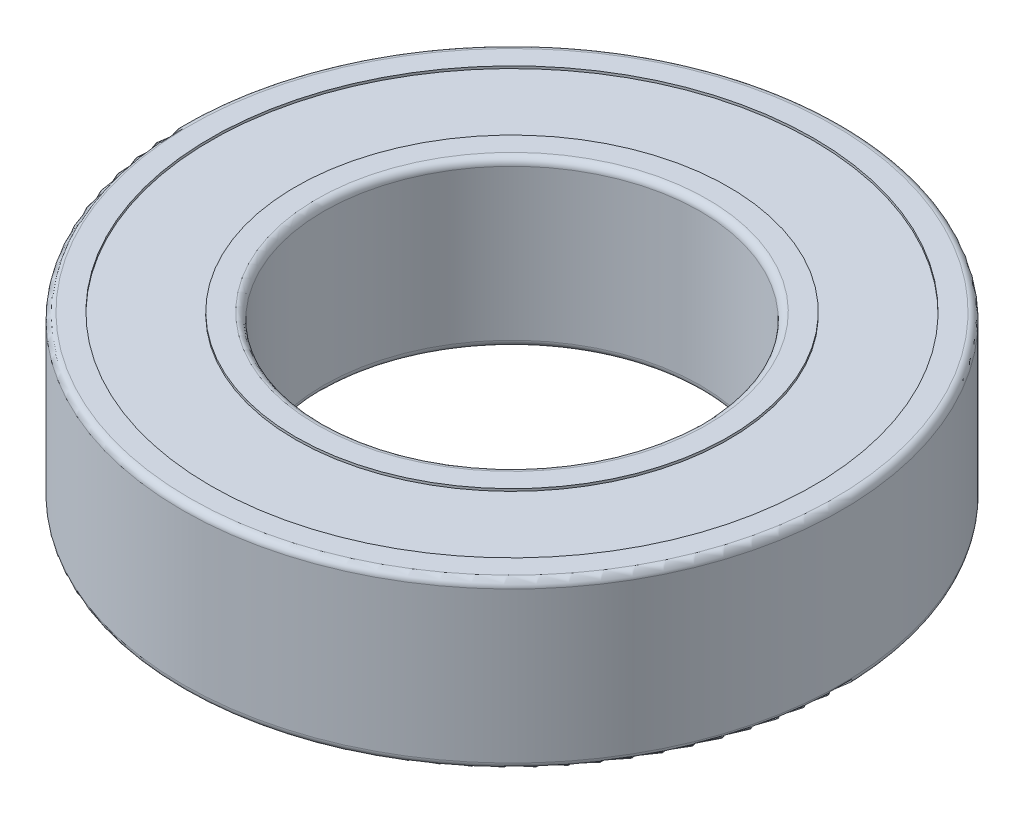
from build123d import *

# Parameters (mm, degrees)
CROQUIS1_R              = 14
CROQUIS1_R_2            = 8
SALIENTE_EXTRUIR1_DEPTH = 7
CROQUIS2_R              = 12.8
CROQUIS2_R_2            = 9.2
CORTAR_EXTRUIR1_DEPTH   = 0.1
REDONDEO1_R             = 0.3


with BuildPart() as part:
    # Croquis1 → Saliente-Extruir1 (new body)
    with BuildSketch(Plane(origin=(0, 0, 0), x_dir=(1, 0, 0), z_dir=(0, 1, 0))):
        with Locations(Location((0, 0, 0), (0, 0, 270))):
            Circle(CROQUIS1_R)
        with Locations(Location((0, 0, 0), (0, 0, 270))):
            Circle(CROQUIS1_R_2, mode=Mode.SUBTRACT)
    extrude(amount=SALIENTE_EXTRUIR1_DEPTH)

    # Croquis2 → Cortar-Extruir1 (cut)
    with BuildSketch(Plane(origin=(0, 7, 0), x_dir=(1, 0, 0), z_dir=(0, 1, 0))):
        with Locations(Location((0, 0, 0), (0, 0, 270))):
            Circle(CROQUIS2_R)
        with Locations(Location((0, 0, 0), (0, 0, 270))):
            Circle(CROQUIS2_R_2, mode=Mode.SUBTRACT)
    cortar_extruir1 = extrude(amount=-CORTAR_EXTRUIR1_DEPTH, mode=Mode.SUBTRACT)

    # Simetría1: Cortar-Extruir1 across plane
    add(cortar_extruir1.mirror(Plane.ZX.offset(3.5)), mode=Mode.SUBTRACT)

    # Redondeo1
    redondeo1_edges = [part.edges().sort_by_distance(p)[0] for p in [
        (0, 0, -14),
        (0, 7, -14),
        (0, 0, -8),
        (0, 7, -8),
    ]]
    fillet(redondeo1_edges, radius=REDONDEO1_R)


solid = part.part
